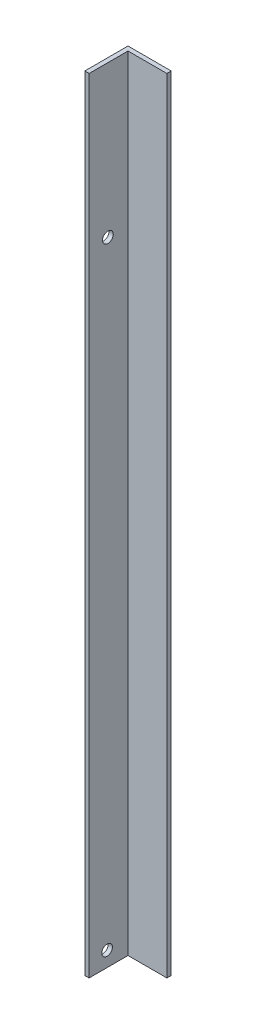
from build123d import *

# Parameters (mm, degrees)
EXTRUDE_THIN1_DEPTH = 460.375
SKETCH3_R           = 3.175
CUT_EXTRUDE1_DEPTH  = 462.277209629
SKETCH4_R           = 3.111919631
CUT_EXTRUDE2_DEPTH  = 462.277209629


with BuildPart() as part:
    # Sketch1 → Extrude-Thin1 (new body)
    with BuildSketch(Plane(origin=(0, 0, 0), x_dir=(1, 0, 0), z_dir=(0, 1, 0))):
        Polygon((-24.9936, -7.8232), (-24.9936, 17.5768), (0.4064, 17.5768), (0.4064, 15.0368), (-22.4536, 15.0368), (-22.4536, -7.8232), align=None)
    extrude(amount=EXTRUDE_THIN1_DEPTH)

    # Sketch3 → Cut-Extrude1 (cut, through all)
    with BuildSketch(Plane(origin=(-22.4536, 0, 0), x_dir=(0, 0, -1), z_dir=(1, 0, 0))):
        with Locations((3.205834921, 371.475)):
            Circle(SKETCH3_R)
    extrude(amount=-CUT_EXTRUDE1_DEPTH, mode=Mode.SUBTRACT)

    # Sketch4 → Cut-Extrude2 (cut, through all)
    with BuildSketch(Plane(origin=(-22.4536, 0, 0), x_dir=(0, 0, -1), z_dir=(1, 0, 0))):
        with Locations((2.761783971, 8.89)):
            Circle(SKETCH4_R)
    extrude(amount=-CUT_EXTRUDE2_DEPTH, mode=Mode.SUBTRACT)


solid = part.part
